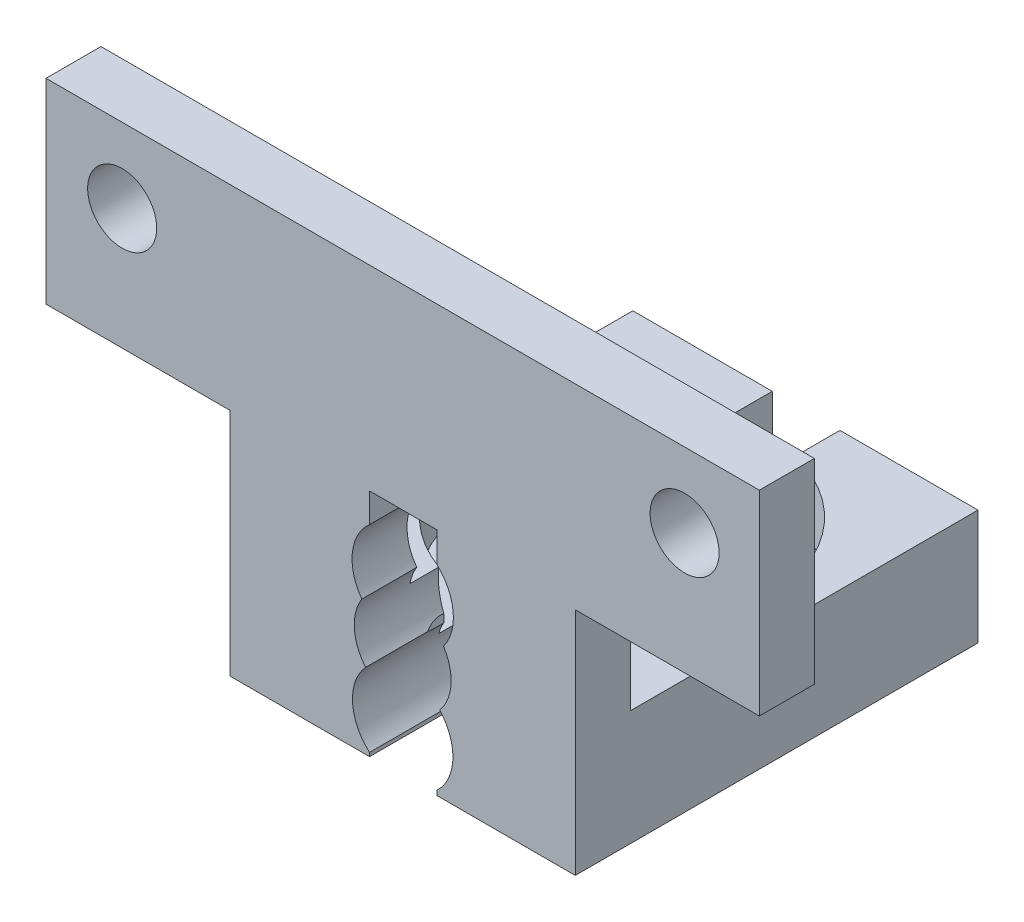
from build123d import *

# Parameters (mm, degrees)
SKETCH_1_W                = 70
SKETCH_1_H                = 43
EXTRUDE_1_DEPTH           = 10
SKETCH_8_W                = 24.88
SKETCH_8_H                = 5
CUT_EXTRUDE_4_DEPTH       = 57.338264084
EXTRUDE_1_2_DEPTH         = 5
EXTRUDE_1_2_DEPTH_BACK    = 2
SKETCH_11_R               = 20.45
SKETCH_11_R_2             = 12.45
CUT_EXTRUDE_6_DEPTH       = 5
CUT_EXTRUDE_7_DEPTH       = 5
SKETCH_16_W               = 5.88
SKETCH_16_H               = 11
CUT_EXTRUDE_8_DEPTH       = 5
SKETCH_17_W               = 5.88
SKETCH_17_H               = 8.352111755
CUT_EXTRUDE_9_DEPTH       = 5
CUT_EXTRUDE_10_DEPTH      = 5
CUT_EXTRUDE_11_DEPTH      = 5
SKETCH_21_R               = 3
CUT_EXTRUDE_12_DEPTH      = 43.275879648
SKETCH_22_R               = 3
CUT_EXTRUDE_13_DEPTH      = 43.275879648
SKETCH_24_R               = 3.51
CUT_EXTRUDE_15_DEPTH      = 7
SKETCH_25_W               = 22.5
SKETCH_25_H               = 10
EXTRUDE_2_DEPTH           = 5
SKETCH_26_W               = 22.62
SKETCH_26_H               = 10
EXTRUDE_3_DEPTH           = 5
SKETCH_28_W               = 5.88
SKETCH_28_H               = 7.531424881
CUT_EXTRUDE_16_DEPTH      = 5
CUT_EXTRUDE_2_DEPTH       = 45
CUT_EXTRUDE_2_DEPTH_BACK  = 31
SKETCH_32_W               = 110
SKETCH_32_H               = 112
SKETCH_32_W_2             = 30
SKETCH_32_H_2             = 32
SKETCH_33_W               = 12
SKETCH_33_H               = 10
SKETCH_33_W_2             = 12.12
EXTRUDE_5_DEPTH           = 3
SKETCH_40_W               = 12
SKETCH_40_H               = 4.777354505
EXTRUDE_7_DEPTH           = 10
SKETCH_41_W               = 12.12
SKETCH_41_H               = 4.777354505
EXTRUDE_8_DEPTH           = 10
CUT_EXTRUDE_17_DEPTH      = 10
CUT_EXTRUDE_17_DEPTH_BACK = 10
SKETCH_42_R               = 4.209320402
SKETCH_53_W               = 4.777354505
SKETCH_53_H               = 10
EXTRUDE_9_DEPTH           = 11
SKETCH_56_W               = 4.777354505
SKETCH_56_H               = 20
EXTRUDE_10_DEPTH          = 11
SKETCH_57_W               = 4.777354505
SKETCH_57_H               = 10
CUT_EXTRUDE_18_DEPTH      = 11
SKETCH_58_W               = 4.777354505
SKETCH_58_H               = 10
EXTRUDE_11_DEPTH          = 5
SKETCH_59_W               = 4.777354505
SKETCH_59_H               = 10
EXTRUDE_12_DEPTH          = 5
SKETCH_60_W               = 62
SKETCH_60_H               = 4.777354505
EXTRUDE_13_DEPTH          = 10
SKETCH_61_W               = 5.88
SKETCH_61_H               = 5
CUT_EXTRUDE_19_DEPTH      = 10
SKETCH_69_W               = 4.777354505
SKETCH_69_H               = 10
EXTRUDE_14_DEPTH          = 16
SKETCH_70_W               = 4.777354505
SKETCH_70_H               = 10
EXTRUDE_15_DEPTH          = 16
SKETCH_83_W               = 62
SKETCH_83_H               = 4.777354505
EXTRUDE_16_DEPTH          = 29
SKETCH_86_R               = 3
CUT_EXTRUDE_20_DEPTH      = 76.279479276
SKETCH_85_R               = 3
CUT_EXTRUDE_21_DEPTH      = 76.279479276
SKETCH_87_W               = 62
SKETCH_87_H               = 22
CUT_EXTRUDE_22_DEPTH      = 76.279479276
SKETCH_90_W               = 16.042506896
SKETCH_90_H               = 20
SKETCH_90_W_2             = 16.042536038
CUT_EXTRUDE_23_DEPTH      = 10
SKETCH_91_R               = 4.404741758
CUT_EXTRUDE_24_DEPTH      = 10
SKETCH_92_R               = 4.366810658
CUT_EXTRUDE_25_DEPTH      = 53.335030246


with BuildPart() as part:
    # 草圖1 → Extrude 1 (new body)
    with BuildSketch(Plane(origin=(0, 0, 0), x_dir=(1, 0, 0), z_dir=(0, 1, 0))):
        Rectangle(SKETCH_1_W, SKETCH_1_H)
    extrude(amount=EXTRUDE_1_DEPTH)

    # 草圖8 → 除料-伸長4 (cut, through all)
    with BuildSketch(Plane.XY.offset(21.5)):
        with Locations((0.06, 7.5)):
            Rectangle(SKETCH_8_W, SKETCH_8_H)
    extrude(amount=-CUT_EXTRUDE_4_DEPTH, mode=Mode.SUBTRACT)

    # 草圖11 → Extrude 1 2 (add, two sides: drawn at the far end of the back side and taken through both)
    with BuildSketch(Plane(origin=(0, 5, 0), x_dir=(1, 0, 0), z_dir=(0, 1, 0)).offset(-EXTRUDE_1_2_DEPTH_BACK)):
        with Locations((0.06, 0)):
            Circle(SKETCH_11_R)
        with Locations((0.06, 0)):
            Circle(SKETCH_11_R_2, mode=Mode.SUBTRACT)
    extrude(amount=EXTRUDE_1_2_DEPTH + EXTRUDE_1_2_DEPTH_BACK)

    # 草圖14 → 除料-伸長6 (cut)
    with BuildSketch(Plane(origin=(0, 5, 0), x_dir=(1, 0, 0), z_dir=(0, 1, 0))):
        Polygon((0.06, -20.45), (12.5, -20.45), (12.5, -21.5), (-12.38, -21.5), (-12.38, -20.45), align=None)
    extrude(amount=-CUT_EXTRUDE_6_DEPTH, mode=Mode.SUBTRACT)

    # 草圖15 → 除料-伸長7 (cut)
    with BuildSketch(Plane(origin=(0, 5, 0), x_dir=(1, 0, 0), z_dir=(0, 1, 0))):
        Polygon((0.06, 20.45), (12.5, 20.45), (12.5, 21.5), (-12.38, 21.5), (-12.38, 20.45), align=None)
    extrude(amount=-CUT_EXTRUDE_7_DEPTH, mode=Mode.SUBTRACT)

    # 草圖16 → 除料-伸長8 (cut)
    with BuildSketch(Plane(origin=(0, 10, 0), x_dir=(1, 0, 0), z_dir=(0, 1, 0))):
        with Locations((0.06, 17.597888245)):
            Rectangle(SKETCH_16_W, SKETCH_16_H)
    extrude(amount=-CUT_EXTRUDE_8_DEPTH, mode=Mode.SUBTRACT)

    # 草圖17 → 除料-伸長9 (cut)
    with BuildSketch(Plane(origin=(0, 10, 0), x_dir=(1, 0, 0), z_dir=(0, 1, 0))):
        with Locations((0.06, -16.273944123)):
            Rectangle(SKETCH_17_W, SKETCH_17_H)
    extrude(amount=-CUT_EXTRUDE_9_DEPTH, mode=Mode.SUBTRACT)

    # 草圖19 → 除料-伸長10 (cut)
    with BuildSketch(Plane(origin=(0, 5, 0), x_dir=(1, 0, 0), z_dir=(0, 1, 0))):
        Polygon((-2.88, 20.237561612), (-2.88, 20.45), (2.98755849, 20.45), (3, 20.237561612), align=None)
    extrude(amount=-CUT_EXTRUDE_10_DEPTH, mode=Mode.SUBTRACT)

    # 草圖20 → 除料-伸長11 (cut)
    with BuildSketch(Plane(origin=(0, 5, 0), x_dir=(1, 0, 0), z_dir=(0, 1, 0))):
        Polygon((3, -20.237561612), (3, -20.45), (-2.887827835, -20.45), (-2.88, -20.237561612), align=None)
    extrude(amount=-CUT_EXTRUDE_11_DEPTH, mode=Mode.SUBTRACT)

    # 草圖21 → 除料-伸長12 (cut, through all)
    with BuildSketch(Plane(origin=(0, 10, 0), x_dir=(1, 0, 0), z_dir=(0, 1, 0))):
        with Locations(Location((-25, 11.5, 0), (0, 0, 270))):
            Circle(SKETCH_21_R)
    extrude(amount=-CUT_EXTRUDE_12_DEPTH, mode=Mode.SUBTRACT)

    # 草圖22 → 除料-伸長13 (cut, through all)
    with BuildSketch(Plane(origin=(0, 10, 0), x_dir=(1, 0, 0), z_dir=(0, 1, 0))):
        with Locations(Location((25, 11.5, 0), (0, 0, 270))):
            Circle(SKETCH_22_R)
    extrude(amount=-CUT_EXTRUDE_13_DEPTH, mode=Mode.SUBTRACT)

    # 草圖24 → 除料-伸長15 (cut)
    with BuildSketch(Plane(origin=(0, 5, 0), x_dir=(1, 0, 0), z_dir=(0, 1, 0))):
        with Locations((0, -12.216230782)):
            Circle(SKETCH_24_R)
    extrude(amount=CUT_EXTRUDE_15_DEPTH, mode=Mode.SUBTRACT)

    # 草圖25 → 填料-伸長2 (add)
    with BuildSketch(Plane.XY.offset(21.5)):
        with Locations((23.75, 5)):
            Rectangle(SKETCH_25_W, SKETCH_25_H)
    extrude(amount=EXTRUDE_2_DEPTH)

    # 草圖26 → 填料-伸長3 (add)
    with BuildSketch(Plane.XY.offset(21.5)):
        with Locations((-23.69, 5)):
            Rectangle(SKETCH_26_W, SKETCH_26_H)
    extrude(amount=EXTRUDE_3_DEPTH)

    # 草圖28 → 除料-伸長16 (cut)
    with BuildSketch(Plane(origin=(0, 5, 0), x_dir=(1, 0, 0), z_dir=(0, 1, 0))):
        with Locations((0.06, -17.988357936)):
            Rectangle(SKETCH_28_W, SKETCH_28_H)
    extrude(amount=-CUT_EXTRUDE_16_DEPTH, mode=Mode.SUBTRACT)

    # 草圖32 → 除料-伸長-薄件2 (cut, two sides: drawn at the far end of the back side and taken through both)
    with BuildSketch(Plane(origin=(0, 5, 0), x_dir=(1, 0, 0), z_dir=(0, 1, 0)).offset(-CUT_EXTRUDE_2_DEPTH_BACK)):
        Rectangle(SKETCH_32_W, SKETCH_32_H)
        Rectangle(SKETCH_32_W_2, SKETCH_32_H_2, mode=Mode.SUBTRACT)
    extrude(amount=CUT_EXTRUDE_2_DEPTH + CUT_EXTRUDE_2_DEPTH_BACK, mode=Mode.SUBTRACT)

    # 草圖33 → 填料-伸長5 (add)
    with BuildSketch(Plane.XY.offset(16)):
        with Locations((9, 5)):
            Rectangle(SKETCH_33_W, SKETCH_33_H)
        with Locations((-8.94, 5)):
            Rectangle(SKETCH_33_W_2, SKETCH_33_H)
    extrude(amount=EXTRUDE_5_DEPTH)

    # 草圖40 → 填料-伸長7 (add)
    with BuildSketch(Plane(origin=(0, 10, 0), x_dir=(1, 0, 0), z_dir=(0, 1, 0))):
        with Locations((9, -16.611322748)):
            Rectangle(SKETCH_40_W, SKETCH_40_H)
    extrude(amount=EXTRUDE_7_DEPTH)

    # 草圖41 → 填料-伸長8 (add)
    with BuildSketch(Plane(origin=(0, 10, 0), x_dir=(1, 0, 0), z_dir=(0, 1, 0))):
        with Locations((-8.94, -16.611322748)):
            Rectangle(SKETCH_41_W, SKETCH_41_H)
    extrude(amount=EXTRUDE_8_DEPTH)

    # 草圖42 → 除料-伸長17 (cut, two sides: drawn at the far end of the back side and taken through both)
    with BuildSketch(Plane.XY.offset(14.222645495).offset(-CUT_EXTRUDE_17_DEPTH_BACK)):
        with Locations((0, 9.264740645)):
            Circle(SKETCH_42_R)
    extrude(amount=CUT_EXTRUDE_17_DEPTH + CUT_EXTRUDE_17_DEPTH_BACK, mode=Mode.SUBTRACT)

    # 草圖53 → 填料-伸長9 (add)
    with BuildSketch(Plane.ZY.offset(15)):
        with Locations((16.611322748, 15)):
            Rectangle(SKETCH_53_W, SKETCH_53_H)
    extrude(amount=EXTRUDE_9_DEPTH)

    # 草圖56 → 填料-伸長10 (add)
    with BuildSketch(Plane(origin=(15, 0, 0), x_dir=(0, 0, -1), z_dir=(1, 0, 0))):
        with Locations((-16.611322748, 10)):
            Rectangle(SKETCH_56_W, SKETCH_56_H)
    extrude(amount=EXTRUDE_10_DEPTH)

    # 草圖57 → 除料-伸長18 (cut)
    with BuildSketch(Plane(origin=(26, 0, 0), x_dir=(0, 0, -1), z_dir=(1, 0, 0))):
        with Locations((-16.611322748, 5)):
            Rectangle(SKETCH_57_W, SKETCH_57_H)
    extrude(amount=-CUT_EXTRUDE_18_DEPTH, mode=Mode.SUBTRACT)

    # 草圖58 → 填料-伸長11 (add)
    with BuildSketch(Plane(origin=(26, 0, 0), x_dir=(0, 0, -1), z_dir=(1, 0, 0))):
        with Locations((-16.611322748, 15)):
            Rectangle(SKETCH_58_W, SKETCH_58_H)
    extrude(amount=EXTRUDE_11_DEPTH)

    # 草圖59 → 填料-伸長12 (add)
    with BuildSketch(Plane.ZY.offset(26)):
        with Locations((16.611322748, 15)):
            Rectangle(SKETCH_59_W, SKETCH_59_H)
    extrude(amount=EXTRUDE_12_DEPTH)

    # 草圖60 → 填料-伸長13 (add)
    with BuildSketch(Plane(origin=(0, 20, 0), x_dir=(1, 0, 0), z_dir=(0, 1, 0))):
        with Locations((0, -16.611322748)):
            Rectangle(SKETCH_60_W, SKETCH_60_H)
    extrude(amount=EXTRUDE_13_DEPTH)

    # 草圖61 → 除料-伸長19 (cut)
    with BuildSketch(Plane.XY.offset(14.222645495)):
        with Locations((0.06, 2.5)):
            Rectangle(SKETCH_61_W, SKETCH_61_H)
    extrude(amount=-CUT_EXTRUDE_19_DEPTH, mode=Mode.SUBTRACT)

    # 草圖69 → 填料-伸長14 (add)
    with BuildSketch(Plane(origin=(15, 0, 0), x_dir=(0, 0, -1), z_dir=(1, 0, 0))):
        with Locations((-16.611322748, 5)):
            Rectangle(SKETCH_69_W, SKETCH_69_H)
    extrude(amount=EXTRUDE_14_DEPTH)

    # 草圖70 → 填料-伸長15 (add)
    with BuildSketch(Plane.ZY.offset(15)):
        with Locations((16.611322748, 5)):
            Rectangle(SKETCH_70_W, SKETCH_70_H)
    extrude(amount=EXTRUDE_15_DEPTH)

    # 草圖83 → 填料-伸長16 (add)
    with BuildSketch(Plane(origin=(0, 30, 0), x_dir=(1, 0, 0), z_dir=(0, 1, 0))):
        with Locations((0, -16.611322748)):
            Rectangle(SKETCH_83_W, SKETCH_83_H)
    extrude(amount=EXTRUDE_16_DEPTH)

    # 草圖86 → 除料-伸長20 (cut, through all)
    with BuildSketch(Plane.XY.offset(19)):
        with Locations((-24.38, 30.52)):
            Circle(SKETCH_86_R)
    extrude(amount=-CUT_EXTRUDE_20_DEPTH, mode=Mode.SUBTRACT)

    # 草圖85 → 除料-伸長21 (cut, through all)
    with BuildSketch(Plane.XY.offset(19)):
        with Locations((24.5, 30.52)):
            Circle(SKETCH_85_R)
    extrude(amount=-CUT_EXTRUDE_21_DEPTH, mode=Mode.SUBTRACT)

    # 草圖87 → 除料-伸長22 (cut, through all)
    with BuildSketch(Plane.XY.offset(19)):
        with Locations((0, 48)):
            Rectangle(SKETCH_87_W, SKETCH_87_H)
    extrude(amount=-CUT_EXTRUDE_22_DEPTH, mode=Mode.SUBTRACT)

    # 草圖90 → 除料-伸長23 (cut)
    with BuildSketch(Plane(origin=(0, 0, 14.222645495), x_dir=(-1, 0, 0), z_dir=(0, 0, -1))):
        with Locations((23.021253448, 10)):
            Rectangle(SKETCH_90_W, SKETCH_90_H)
        with Locations((-23.021268019, 10)):
            Rectangle(SKETCH_90_W_2, SKETCH_90_H)
    extrude(amount=-CUT_EXTRUDE_23_DEPTH, mode=Mode.SUBTRACT)

    # 草圖91 → 除料-伸長24 (cut)
    with BuildSketch(Plane.XY.offset(19)):
        with Locations((0, 14.133466634)):
            Circle(SKETCH_91_R)
    extrude(amount=-CUT_EXTRUDE_24_DEPTH, mode=Mode.SUBTRACT)

    # 草圖92 → 除料-伸長25 (cut, through all)
    with BuildSketch(Plane.XY.offset(4.222645495)):
        with Locations((0, 3.605723159)):
            Circle(SKETCH_92_R)
    extrude(amount=CUT_EXTRUDE_25_DEPTH, mode=Mode.SUBTRACT)


solid = part.part
